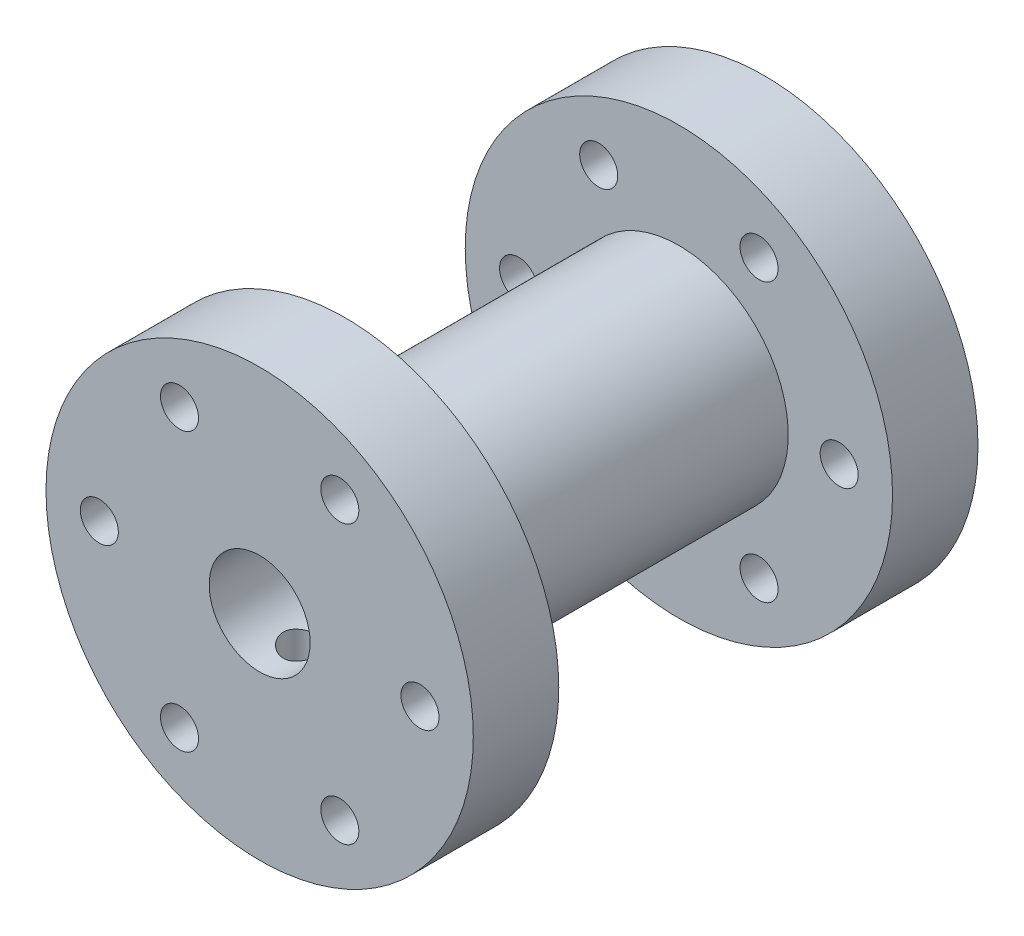
from build123d import *

# Parameters (mm, degrees)
CROQUIS3_R                  = 3
CORTAR_EXTRUIR1_DEPTH       = 35.96541148
TALADRO_ROSCADO_4_403_D     = 2.2606
TALADRO_ROSCADO_4_403_DEPTH = 5.08
TALADRO_ROSCADO_4_405_D     = 2.2606
TALADRO_ROSCADO_4_405_DEPTH = 8.87
TALADRO_ROSCADO_4_405_TIP   = 0.679152758
TALADRO_ROSCADO_4_404_D     = 2.2606
TALADRO_ROSCADO_4_404_DEPTH = 12.699
TALADRO_ROSCADO_4_404_TIP   = 0.679152758


with BuildPart() as part:
    # Croquis2 → Revolución1 (revolve)
    with BuildSketch(Plane(origin=(0, 0, 0), x_dir=(0, 0, -1), z_dir=(1, 0, 0)), mode=Mode.PRIVATE) as revoluci_n1_sk:
        Polygon((-9.92, 6.5), (9.92, 6.5), (9.92, 12.7), (15, 12.7), (15, 0), (-15, 0), (-15, 12.7), (-9.92, 12.7), align=None)
    revolve(revoluci_n1_sk.sketch.rotate(Axis((0, 0, -15), (0, 0, 1)), 90), axis=Axis((0, 0, -15), (0, 0, 1)))

    # Croquis3 → Cortar-Extruir1 (cut, through all)
    with BuildSketch(Plane.XY.offset(15)):
        Circle(CROQUIS3_R)
    extrude(amount=-CORTAR_EXTRUIR1_DEPTH, mode=Mode.SUBTRACT)

    # Taladro roscado #4-403
    with Locations(Plane.XY.offset(-9.92)):
        with Locations((-9.53, 0), (-4.765, 8.253222098), (4.765, 8.253222098), (9.53, 0), (4.765, -8.253222098), (-4.765, -8.253222098), (0, 0)):
            Hole(TALADRO_ROSCADO_4_403_D / 2, depth=TALADRO_ROSCADO_4_403_DEPTH)

    # Taladro roscado #4-405
    with Locations(Plane.XY.offset(15)):
        with Locations((-9.53, 0), (-4.765, 8.253222098), (4.765, 8.253222098), (9.53, 0), (4.765, -8.253222098), (-4.765, -8.253222098)):
            Hole(TALADRO_ROSCADO_4_405_D / 2, depth=TALADRO_ROSCADO_4_405_DEPTH)
            with Locations((0, 0, -(TALADRO_ROSCADO_4_405_DEPTH + TALADRO_ROSCADO_4_405_TIP / 2))):  # 118° drill point
                Cone(0, TALADRO_ROSCADO_4_405_D / 2, TALADRO_ROSCADO_4_405_TIP, mode=Mode.SUBTRACT)

    # Taladro roscado #4-404
    with Locations(Plane(origin=(0, -12.7, 0), x_dir=(-1, 0, 0), z_dir=(0, -1, 0))):
        with Locations((0, 12.46), (0, 6.92), (0, -6.92), (0, -12.46)):
            Hole(TALADRO_ROSCADO_4_404_D / 2, depth=TALADRO_ROSCADO_4_404_DEPTH)
            with Locations((0, 0, -(TALADRO_ROSCADO_4_404_DEPTH + TALADRO_ROSCADO_4_404_TIP / 2))):  # 118° drill point
                Cone(0, TALADRO_ROSCADO_4_404_D / 2, TALADRO_ROSCADO_4_404_TIP, mode=Mode.SUBTRACT)


solid = part.part
